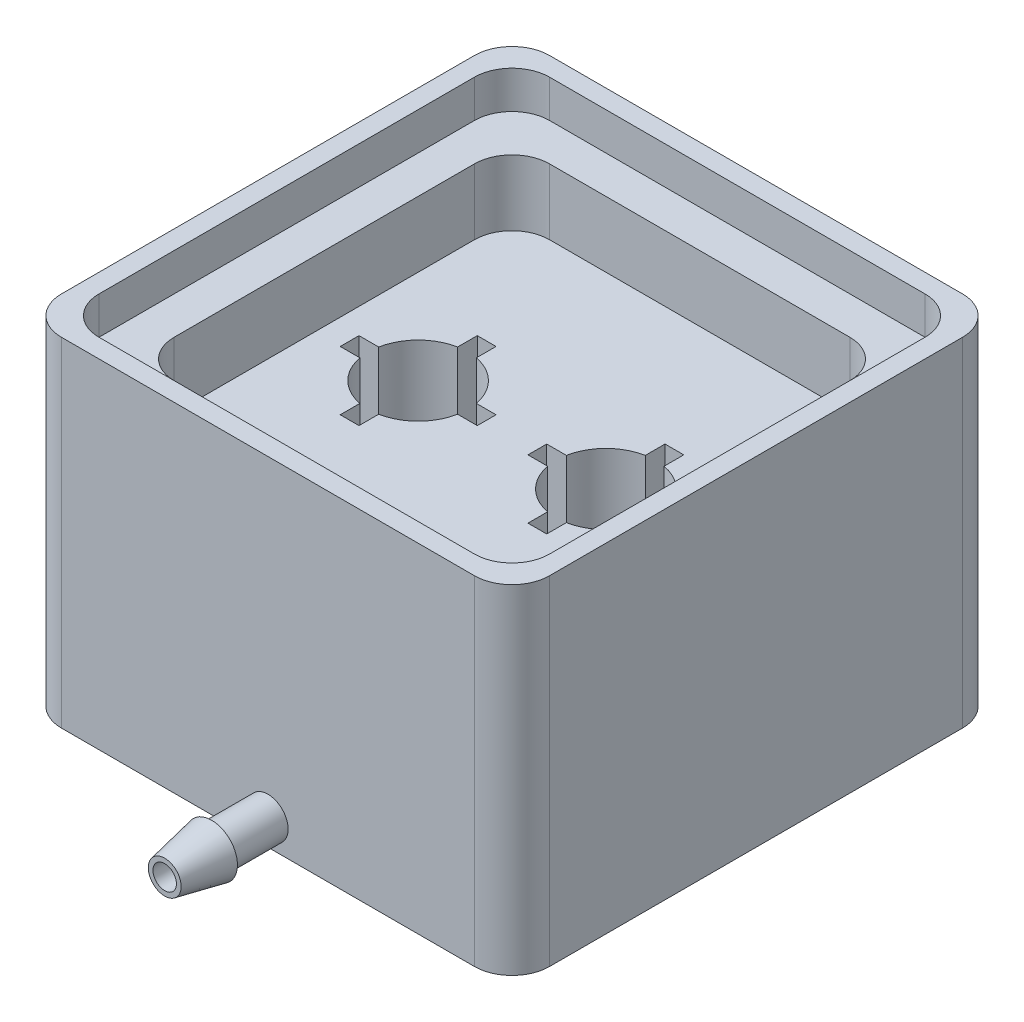
from build123d import *

# Parameters (mm, degrees)
SKETCH1_R                      = 2.65
BOSS_EXTRUDE1_DEPTH            = 12.53
CUT_EXTRUDE1_START             = -11.785
CUT_EXTRUDE1_DEPTH             = 11.785
CUT_EXTRUDE3_REACH             = 27.851
SKETCH10_R                     = 0.625
CUT_EXTRUDE3_DIRECTION_2_REACH = 27.851
CUT_EXTRUDE2_REACH             = 33.654
SKETCH5_R                      = 0.625
BOSS_EXTRUDE2_DEPTH            = 3.5
BOSS_EXTRUDE3_DEPTH            = 2


with BuildPart() as part:
    # Sketch1 → Boss-Extrude1 (new body)
    with BuildSketch(Plane(origin=(0, 0, 0), x_dir=(1, 0, 0), z_dir=(0, 1, 0))):
        with BuildLine():
            Line((-11, -13), (11, -13))
            ThreePointArc((11, -13), (12.414213562, -12.414213562), (13, -11))
            Line((13, -11), (13, 11))
            ThreePointArc((13, 11), (12.414213562, 12.414213562), (11, 13))
            Line((11, 13), (-11, 13))
            ThreePointArc((-11, 13), (-12.414213562, 12.414213562), (-13, 11))
            Line((-13, 11), (-13, -11))
            ThreePointArc((-13, -11), (-12.414213562, -12.414213562), (-11, -13))
        make_face()
        with Locations(Location((5, 0, 0), (0, 0, 90))):
            Circle(SKETCH1_R, mode=Mode.SUBTRACT)
        with Locations(Location((-5, 0, 0), (0, 0, 90))):
            Circle(SKETCH1_R, mode=Mode.SUBTRACT)
    extrude(amount=BOSS_EXTRUDE1_DEPTH)

    # Sketch2 → Cut-Extrude1 (cut)
    with BuildSketch(Plane(origin=(0, 12.53, 0), x_dir=(1, 0, 0), z_dir=(0, 1, 0)).offset(CUT_EXTRUDE1_START)):
        with BuildLine():
            Line((4.5, 3.65), (4.5, 2.602402736))
            ThreePointArc((4.5, 2.602402736), (5, 2.65), (5.5, 2.602402736))
            Line((5.5, 2.602402736), (5.5, 3.65))
            Line((5.5, 3.65), (4.5, 3.65))
        make_face()
        with BuildLine():
            ThreePointArc((7.65, 0), (7.638073848, -0.251130195), (7.602402736, -0.5))
            Line((7.602402736, -0.5), (8.65, -0.5))
            Line((8.65, -0.5), (8.65, 0.5))
            Line((8.65, 0.5), (7.602402736, 0.5))
            ThreePointArc((7.602402736, 0.5), (7.638073848, 0.251130195), (7.65, 0))
        make_face()
        with BuildLine():
            Line((4.5, -2.602402736), (4.5, -3.65))
            Line((4.5, -3.65), (5.5, -3.65))
            Line((5.5, -3.65), (5.5, -2.602402736))
            ThreePointArc((5.5, -2.602402736), (5, -2.65), (4.5, -2.602402736))
        make_face()
        with BuildLine():
            Line((1.35, -0.5), (2.397597264, -0.5))
            ThreePointArc((2.397597264, -0.5), (2.35, 0), (2.397597264, 0.5))
            Line((2.397597264, 0.5), (1.35, 0.5))
            Line((1.35, 0.5), (1.35, -0.5))
        make_face()
        with BuildLine():
            ThreePointArc((-2.35, 0), (-2.361926152, -0.251130195), (-2.397597264, -0.5))
            Line((-2.397597264, -0.5), (-1.35, -0.5))
            Line((-1.35, -0.5), (-1.35, 0.5))
            Line((-1.35, 0.5), (-2.397597264, 0.5))
            ThreePointArc((-2.397597264, 0.5), (-2.361926152, 0.251130195), (-2.35, 0))
        make_face()
        with BuildLine():
            Line((-5.5, 3.65), (-5.5, 2.602402736))
            ThreePointArc((-5.5, 2.602402736), (-5, 2.65), (-4.5, 2.602402736))
            Line((-4.5, 2.602402736), (-4.5, 3.65))
            Line((-4.5, 3.65), (-5.5, 3.65))
        make_face()
        with BuildLine():
            Line((-8.65, 0.5), (-8.65, -0.5))
            Line((-8.65, -0.5), (-7.602402736, -0.5))
            ThreePointArc((-7.602402736, -0.5), (-7.65, 0), (-7.602402736, 0.5))
            Line((-7.602402736, 0.5), (-8.65, 0.5))
        make_face()
        with BuildLine():
            ThreePointArc((-4.5, -2.602402736), (-5, -2.65), (-5.5, -2.602402736))
            Line((-5.5, -2.602402736), (-5.5, -3.65))
            Line((-5.5, -3.65), (-4.5, -3.65))
            Line((-4.5, -3.65), (-4.5, -2.602402736))
        make_face()
    extrude(amount=CUT_EXTRUDE1_DEPTH, mode=Mode.SUBTRACT)

    # Sketch3 → Revolve1 (revolve)
    with BuildSketch(Plane(origin=(0, 0, 0), x_dir=(0, 0, -1), z_dir=(1, 0, 0)), mode=Mode.PRIVATE) as revolve1_sk:
        Polygon((-13, 0.3), (-16, 0.3), (-16, 0), (-18.5, 0.5), (-18.5, 0.75), (-13, 0.75), align=None)
    revolve(revolve1_sk.sketch.rotate(Axis((0, 1.375, 13), (0, 0, 1)), 180), axis=Axis((0, 1.375, 13), (0, 0, 1)))

    # Sketch10 → Cut-Extrude3 (cut, up to next)
    with BuildSketch(Plane(origin=(0, 0, 0), x_dir=(0, 0, -1), z_dir=(1, 0, 0)), mode=Mode.PRIVATE) as cut_extrude3_sk1:
        with Locations(Location((0, 1.375, 0), (0, 0, 143.130102406))):
            Circle(SKETCH10_R)
    cut_extrude3_tool1 = extrude(cut_extrude3_sk1.sketch, amount=-CUT_EXTRUDE3_REACH, mode=Mode.PRIVATE) & part.part
    add(cut_extrude3_tool1.solids().sort_by_distance((0, 1.375, 0))[0], mode=Mode.SUBTRACT)

    # Sketch10 → Cut-Extrude3 direction 2 (cut, up to next)
    with BuildSketch(Plane(origin=(0, 0, 0), x_dir=(0, 0, -1), z_dir=(1, 0, 0)), mode=Mode.PRIVATE) as cut_extrude3_direction_2_sk1:
        with Locations(Location((0, 1.375, 0), (0, 0, 143.130102406))):
            Circle(SKETCH10_R)
    cut_extrude3_direction_2_tool1 = extrude(cut_extrude3_direction_2_sk1.sketch, amount=CUT_EXTRUDE3_DIRECTION_2_REACH, mode=Mode.PRIVATE) & part.part
    add(cut_extrude3_direction_2_tool1.solids().sort_by_distance((0, 1.375, 0))[0], mode=Mode.SUBTRACT)

    # Sketch5 → Cut-Extrude2 (cut, up to next)
    with BuildSketch(Plane.XY.offset(13), mode=Mode.PRIVATE) as cut_extrude2_sk1:
        with Locations(Location((0, 1.375, 0), (0, 0, 90))):
            Circle(SKETCH5_R)
    cut_extrude2_tool1 = extrude(cut_extrude2_sk1.sketch, amount=-CUT_EXTRUDE2_REACH, mode=Mode.PRIVATE) & part.part
    add(cut_extrude2_tool1.solids().sort_by_distance((0, 1.375, 13))[0], mode=Mode.SUBTRACT)

    # Sketch6 → Boss-Extrude2 (add)
    with BuildSketch(Plane(origin=(0, 12.53, 0), x_dir=(1, 0, 0), z_dir=(0, 1, 0))):
        with BuildLine():
            Line((-11, -13), (11, -13))
            ThreePointArc((11, -13), (12.414213562, -12.414213562), (13, -11))
            Line((13, -11), (13, 11))
            ThreePointArc((13, 11), (12.414213562, 12.414213562), (11, 13))
            Line((11, 13), (-11, 13))
            ThreePointArc((-11, 13), (-12.414213562, 12.414213562), (-13, 11))
            Line((-13, 11), (-13, -11))
            ThreePointArc((-13, -11), (-12.414213562, -12.414213562), (-11, -13))
        make_face()
        with BuildLine():
            Line((-8, -10), (8, -10))
            ThreePointArc((8, -10), (9.414213562, -9.414213562), (10, -8))
            Line((10, -8), (10, 8))
            ThreePointArc((10, 8), (9.414213562, 9.414213562), (8, 10))
            Line((8, 10), (-8, 10))
            ThreePointArc((-8, 10), (-9.414213562, 9.414213562), (-10, 8))
            Line((-10, 8), (-10, -8))
            ThreePointArc((-10, -8), (-9.414213562, -9.414213562), (-8, -10))
        make_face(mode=Mode.SUBTRACT)
    extrude(amount=BOSS_EXTRUDE2_DEPTH)

    # Sketch8 → Boss-Extrude3 (add)
    with BuildSketch(Plane(origin=(0, 16.03, 0), x_dir=(1, 0, 0), z_dir=(0, 1, 0))):
        with BuildLine():
            Line((-11, -13), (11, -13))
            ThreePointArc((11, -13), (12.414213562, -12.414213562), (13, -11))
            Line((13, -11), (13, 11))
            ThreePointArc((13, 11), (12.414213562, 12.414213562), (11, 13))
            Line((11, 13), (-11, 13))
            ThreePointArc((-11, 13), (-12.414213562, 12.414213562), (-13, 11))
            Line((-13, 11), (-13, -11))
            ThreePointArc((-13, -11), (-12.414213562, -12.414213562), (-11, -13))
        make_face()
        with BuildLine():
            Line((-10, -12), (10, -12))
            ThreePointArc((10, -12), (11.414213562, -11.414213562), (12, -10))
            Line((12, -10), (12, 10))
            ThreePointArc((12, 10), (11.414213562, 11.414213562), (10, 12))
            Line((10, 12), (-10, 12))
            ThreePointArc((-10, 12), (-11.414213562, 11.414213562), (-12, 10))
            Line((-12, 10), (-12, -10))
            ThreePointArc((-12, -10), (-11.414213562, -11.414213562), (-10, -12))
        make_face(mode=Mode.SUBTRACT)
    extrude(amount=BOSS_EXTRUDE3_DEPTH)


solid = part.part
